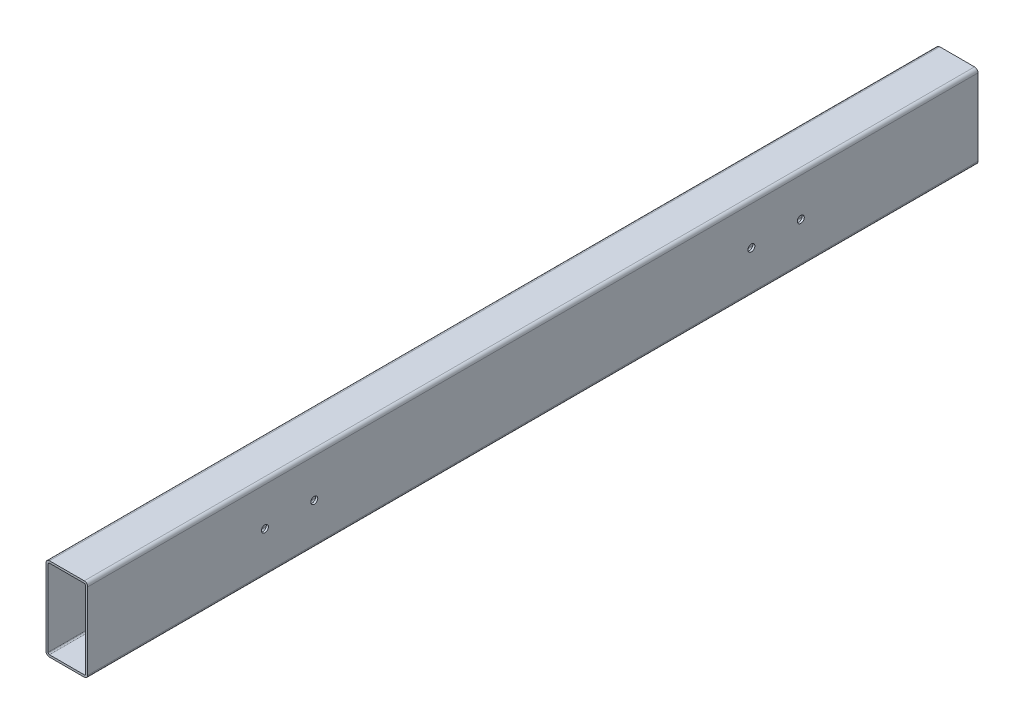
from build123d import *

# Parameters (mm, degrees)
EXTRUDE_THIN1_DEPTH      = 640
EXTRUDE_THIN1_DEPTH_BACK = 640
CUT_EXTRUDE1_DEPTH       = 644.506021728
CUT_EXTRUDE1_DEPTH_BACK  = 644.506021728
SKETCH2_R                = 5


with BuildPart() as part:
    # Sketch1 → Extrude-Thin1 (new, two sides: drawn at the far end of the back side and taken through both)
    with BuildSketch(Plane.XY.offset(-EXTRUDE_THIN1_DEPTH_BACK)):
        with BuildLine():
            Line((-30, 55), (-30, -55))
            ThreePointArc((-30, -55), (-28.535533906, -58.535533906), (-25, -60))
            Line((-25, -60), (25, -60))
            ThreePointArc((25, -60), (28.535533906, -58.535533906), (30, -55))
            Line((30, -55), (30, 55))
            ThreePointArc((30, 55), (28.535533906, 58.535533906), (25, 60))
            Line((25, 60), (-25, 60))
            ThreePointArc((-25, 60), (-28.535533906, 58.535533906), (-30, 55))
        make_face()
        with BuildLine():
            Line((-27, 55), (-27, -55))
            ThreePointArc((-27, -55), (-26.414213562, -56.414213562), (-25, -57))
            Line((-25, -57), (25, -57))
            ThreePointArc((25, -57), (26.414213562, -56.414213562), (27, -55))
            Line((27, -55), (27, 55))
            ThreePointArc((27, 55), (26.414213562, 56.414213562), (25, 57))
            Line((25, 57), (-25, 57))
            ThreePointArc((-25, 57), (-26.414213562, 56.414213562), (-27, 55))
        make_face(mode=Mode.SUBTRACT)
    extrude(amount=EXTRUDE_THIN1_DEPTH + EXTRUDE_THIN1_DEPTH_BACK)

    # Sketch2 → Cut-Extrude1 (cut, two sides: drawn at the far end of the back side and taken through both)
    with BuildSketch(Plane(origin=(0, 0, 0), x_dir=(0, 0, -1), z_dir=(1, 0, 0)).offset(-CUT_EXTRUDE1_DEPTH_BACK)):
        with Locations((-314.25, 0)):
            Circle(SKETCH2_R)
        with Locations((-385.25, 0)):
            Circle(SKETCH2_R)
        with Locations((314.25, 0)):
            Circle(SKETCH2_R)
        with Locations((385.25, 0)):
            Circle(SKETCH2_R)
    extrude(amount=CUT_EXTRUDE1_DEPTH + CUT_EXTRUDE1_DEPTH_BACK, mode=Mode.SUBTRACT)


solid = part.part
